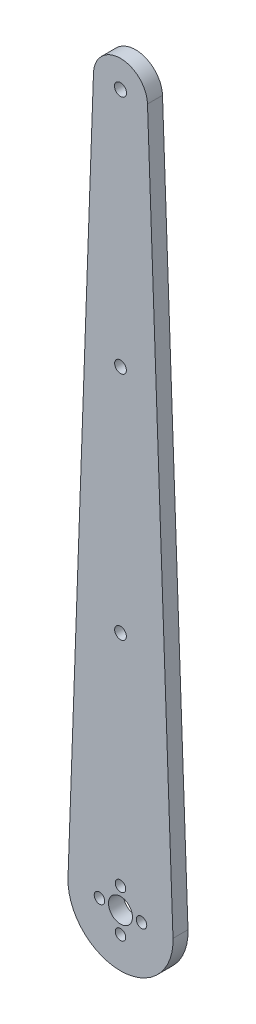
from build123d import *

# Parameters (mm, degrees)
SKETCH7_R                = 4
SKETCH7_R_2              = 2
BOSS_EXTRUDE1_DEPTH      = 5
HOLE_WIZARD_M3_5_1_D     = 3.9
HOLE_WIZARD_M3_5_1_DEPTH = 10
HOLE_WIZARD_M3_5_1_TIP   = 1.171678207
SKETCH_4_R               = 1.75
CUT_EXTRUDE_1_DEPTH      = 10


with BuildPart() as part:
    # Sketch7 → Boss-Extrude1 (new body)
    with BuildSketch(Plane.XY):
        with BuildLine():
            Line((8.994200014, 237.123057432), (17.48872225, 0.62816723))
            ThreePointArc((17.48872225, 0.62816723), (0, -17.5), (-17.48872225, 0.62816723))
            Line((-17.48872225, 0.62816723), (-8.994200014, 237.123057432))
            ThreePointArc((-8.994200014, 237.123057432), (0, 245.8), (8.994200014, 237.123057432))
        make_face()
        Circle(SKETCH7_R, mode=Mode.SUBTRACT)
        with Locations((0, 236.8)):
            Circle(SKETCH7_R_2, mode=Mode.SUBTRACT)
    extrude(amount=-BOSS_EXTRUDE1_DEPTH)

    # M3.5 间隙孔1
    with Locations(Plane(origin=(0, 156.8, 0), x_dir=(1, 0, 0), z_dir=(0, 0, 1))):
        with Locations((0, 0), (0, -76.8)):
            Hole(HOLE_WIZARD_M3_5_1_D / 2, depth=HOLE_WIZARD_M3_5_1_DEPTH)
            with Locations((0, 0, -(HOLE_WIZARD_M3_5_1_DEPTH + HOLE_WIZARD_M3_5_1_TIP / 2))):  # 118° drill point
                Cone(0, HOLE_WIZARD_M3_5_1_D / 2, HOLE_WIZARD_M3_5_1_TIP, mode=Mode.SUBTRACT)

    # 草图4 → 切除-拉伸1 (cut)
    with BuildSketch(Plane.XY):
        with Locations((7, 0)):
            Circle(SKETCH_4_R)
        with Locations((0, 7)):
            Circle(SKETCH_4_R)
        with Locations((0, -7)):
            Circle(SKETCH_4_R)
        with Locations((-7, 0)):
            Circle(SKETCH_4_R)
    extrude(amount=-CUT_EXTRUDE_1_DEPTH, mode=Mode.SUBTRACT)


solid = part.part
